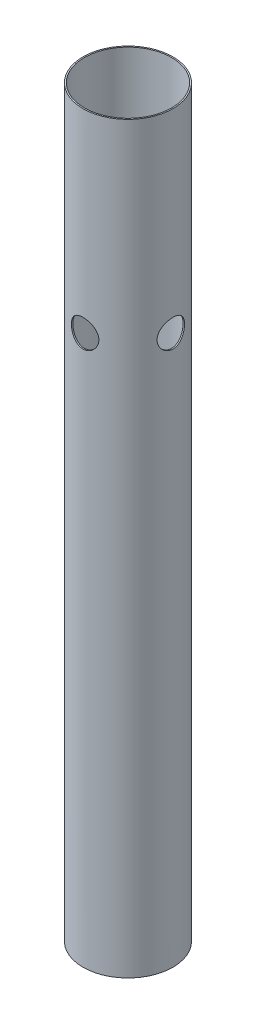
from build123d import *

# Parameters (mm, degrees)
SKETCH2_R           = 39.3
SKETCH2_R_2         = 38.15
BOSS_EXTRUDE1_DEPTH = 650
SKETCH3_R           = 12
CUT_EXTRUDE1_DEPTH  = 653.371811163
CIRPATTERN1_COUNT   = 4


with BuildPart() as part:
    # Sketch2 → Boss-Extrude1 (new body)
    with BuildSketch(Plane(origin=(0, 0, 0), x_dir=(1, 0, 0), z_dir=(0, 1, 0))):
        with Locations(Location((0, 0, 0), (0, 0, 270))):
            Circle(SKETCH2_R)
        with Locations(Location((0, 0, 0), (0, 0, 270))):
            Circle(SKETCH2_R_2, mode=Mode.SUBTRACT)
    extrude(amount=BOSS_EXTRUDE1_DEPTH)

    # Sketch3 → Cut-Extrude1 (cut, through all)
    with BuildSketch(Plane.XY):
        with Locations(Location((0, 480, 0), (0, 0, 90))):
            Circle(SKETCH3_R)
    cut_extrude1 = extrude(amount=-CUT_EXTRUDE1_DEPTH, mode=Mode.SUBTRACT)

    # CirPattern1: Cut-Extrude1 ×4 about axis
    cirpattern1_axis = Axis((0, 650, 0), (0, -1, 0))
    for i in range(1, CIRPATTERN1_COUNT):
        add(cut_extrude1.rotate(cirpattern1_axis, i * 360 / CIRPATTERN1_COUNT), mode=Mode.SUBTRACT)


solid = part.part
